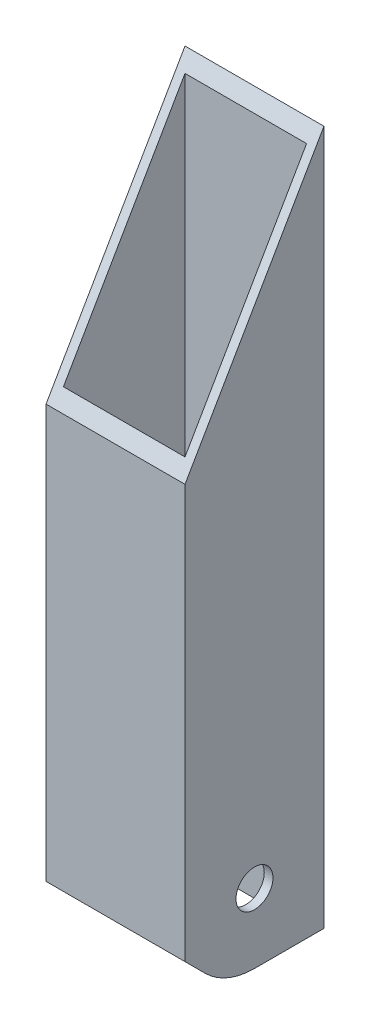
from build123d import *

# Parameters (mm, degrees)
SKETCH1_W               = 25.4
SKETCH1_H               = 25.4
SKETCH1_W_2             = 22.225
SKETCH1_H_2             = 22.225
EXTRUDE1_DEPTH          = 127
EXTRUDE3_DEPTH          = 131.136274728
F_1_4_CLEARANCE_HOLE1_D = 6.7564
EXTRUDE4_DEPTH          = 131.136274728
EXTRUDE5_DEPTH          = 131.136274728


with BuildPart() as part:
    # Sketch1 → Extrude1 (new body)
    with BuildSketch(Plane(origin=(0, 0, 0), x_dir=(1, 0, 0), z_dir=(0, 1, 0))):
        Rectangle(SKETCH1_W, SKETCH1_H)
        Rectangle(SKETCH1_W_2, SKETCH1_H_2, mode=Mode.SUBTRACT)
    extrude(amount=EXTRUDE1_DEPTH)

    # Sketch3 → Extrude3 (cut, through all)
    with BuildSketch(Plane(origin=(12.7, 0, 0), x_dir=(0, 0, -1), z_dir=(1, 0, 0))):
        Polygon((12.7, 127), (-12.7, 127), (-12.7, 83.005909488), align=None)
    extrude(amount=-EXTRUDE3_DEPTH, mode=Mode.SUBTRACT)

    # 1/4 Clearance Hole1 (through all)
    with Locations(Plane(origin=(12.7, 0, 0), x_dir=(0, 0, -1), z_dir=(1, 0, 0))):
        with Locations((0, 12.7)):
            Hole(F_1_4_CLEARANCE_HOLE1_D / 2)

    # Sketch7 → Extrude4 (cut, through all)
    with BuildSketch(Plane(origin=(12.7, 0, 0), x_dir=(0, 0, -1), z_dir=(1, 0, 0))):
        Polygon((-5.260512242, 0), (-12.7, 7.439487758), (-12.7, 0), align=None)
    extrude(amount=-EXTRUDE4_DEPTH, mode=Mode.SUBTRACT)

    # Sketch8 → Extrude5 (cut, through all)
    with BuildSketch(Plane(origin=(12.7, 0, 0), x_dir=(0, 0, -1), z_dir=(1, 0, 0))):
        with BuildLine():
            Line((0, 0), (-5.260512242, 0))
            Line((-5.260512242, 0), (-8.980256121, 3.719743879))
            ThreePointArc((-8.980256121, 3.719743879), (-4.860079591, 0.966729937), (0, 0))
        make_face()
    extrude(amount=-EXTRUDE5_DEPTH, mode=Mode.SUBTRACT)


solid = part.part
